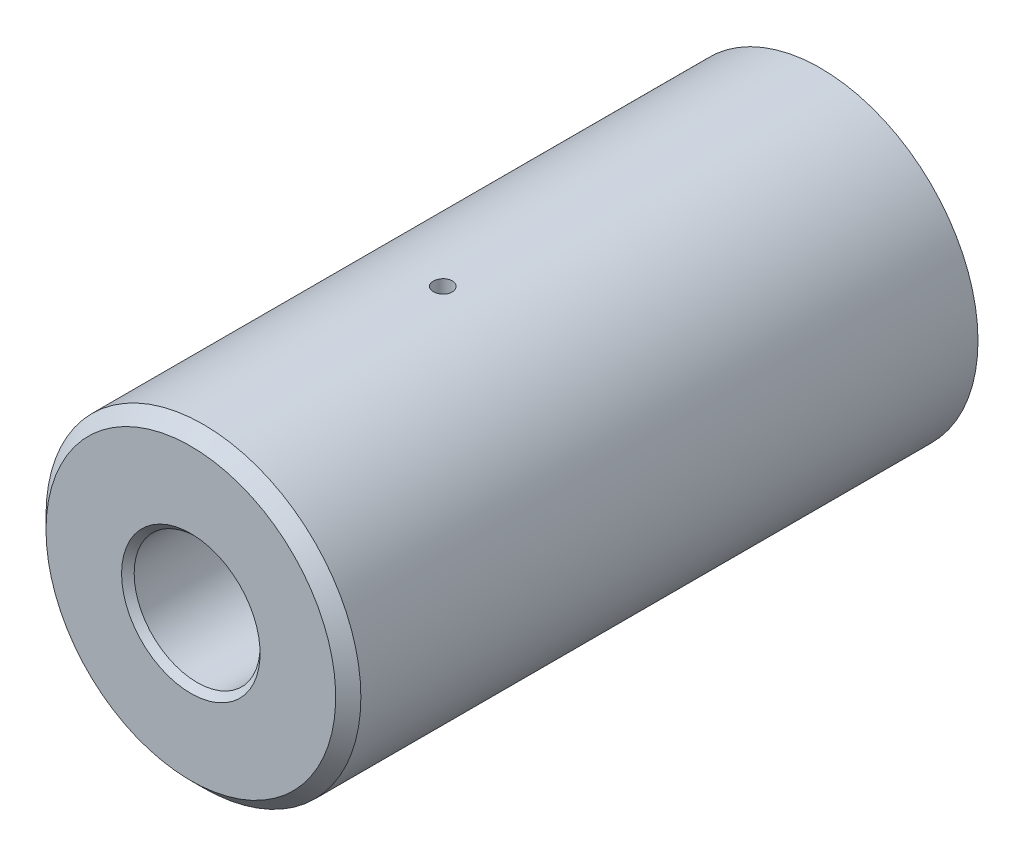
from build123d import *

# Parameters (mm, degrees)
SMUSSO1_SIZE   = 1
SMUSSO2_SIZE   = 2
RACCORDO1_R    = 2
FORO_3_0_3_1_D = 3


with BuildPart() as part:
    # Schizzo1 → Rivoluzione1 (revolve)
    with BuildSketch(Plane(origin=(0, 0, 0), x_dir=(0, 0, -1), z_dir=(1, 0, 0)), mode=Mode.PRIVATE) as rivoluzione1_sk:
        Polygon((-20.837168328, 15), (-20.837168328, 10), (-45.837168328, 10), (-45.837168328, 25), (54.162831672, 25), (54.162831672, 15), (19.162831672, 15), (19.162831672, 18), (14.162831672, 18), (14.162831672, 15), align=None)
    revolve(rivoluzione1_sk.sketch.rotate(Axis((0, 0, 55.346650187), (0, 0, -1)), 90), axis=Axis((0, 0, 55.346650187), (0, 0, -1)))

    # Smusso1
    smusso1_edges = [part.edges().sort_by_distance(p)[0] for p in [
        (-15, 0, -54.162831672),
        (-10, 0, 45.837168328),
    ]]
    chamfer(smusso1_edges, length=SMUSSO1_SIZE)

    # Smusso2
    smusso2_edges = [part.edges().sort_by_distance(p)[0] for p in [
        (-25, 0, 45.837168328),
    ]]
    chamfer(smusso2_edges, length=SMUSSO2_SIZE)

    # Raccordo1
    raccordo1_edges = [part.edges().sort_by_distance(p)[0] for p in [
        (-15, 0, 20.837168328),
    ]]
    fillet(raccordo1_edges, radius=RACCORDO1_R)

    # Foro Ø3.0 (3)-1 (through all)
    with Locations(Plane(origin=(0, -25, 0), x_dir=(-1, 0, 0), z_dir=(0, -1, 0))):
        with Locations((0, -5.837168328)):
            Hole(FORO_3_0_3_1_D / 2)


solid = part.part
